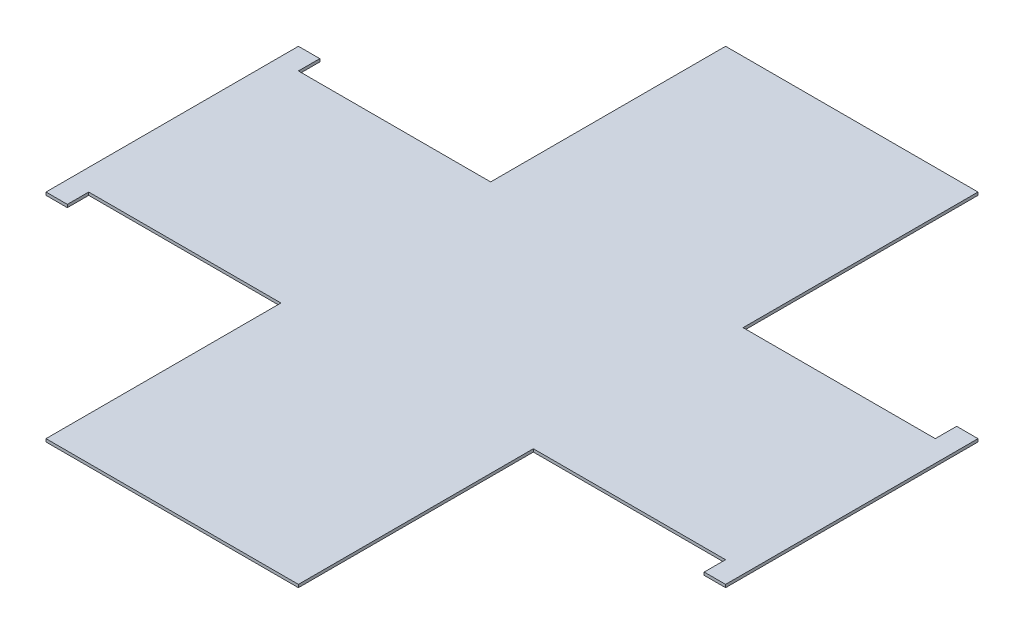
from build123d import *

# Parameters (mm, degrees)
BOSS_EXTRUDE1_DEPTH = 3


with BuildPart() as part:
    # Sketch1 → Boss-Extrude1 (new body)
    with BuildSketch(Plane(origin=(0, 0, 0), x_dir=(1, 0, 0), z_dir=(0, 1, 0))):
        Polygon((-350, -130), (-328, -130), (-328, -108), (-130, -108), (-130, -130), (-130, -350), (130, -350), (130, -130), (130, -108), (328, -108), (328, -130), (350, -130), (350, 130), (328, 130), (328, 108), (130, 108), (130, 130), (130, 350), (-130, 350), (-130, 130), (-130, 108), (-328, 108), (-328, 130), (-350, 130), align=None)
    extrude(amount=BOSS_EXTRUDE1_DEPTH)


solid = part.part
